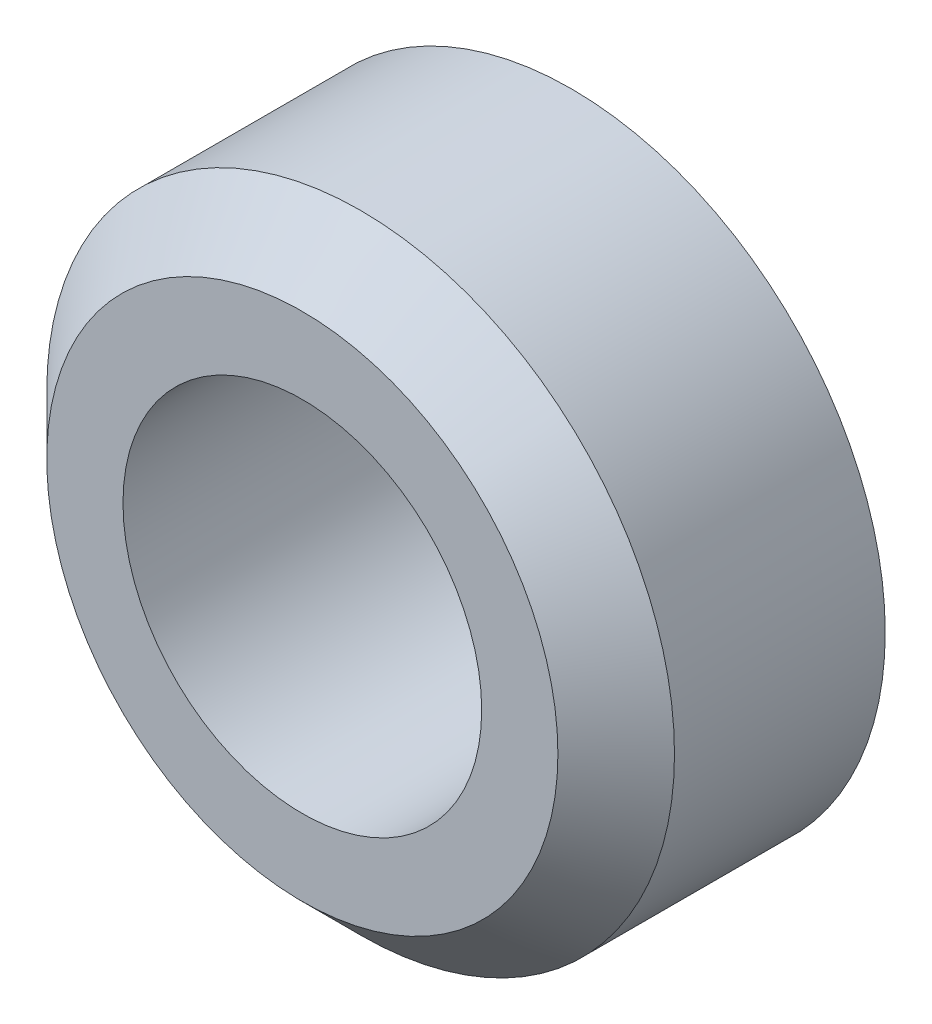
from build123d import *

# Parameters (mm, degrees)
SKETCH2_R           = 7
SKETCH2_R_2         = 4
BOSS_EXTRUDE1_DEPTH = 6
CHAMFER1_SIZE       = 1.3


with BuildPart() as part:
    # Sketch2 → Boss-Extrude1 (new body)
    with BuildSketch(Plane(origin=(0, 0, 0), x_dir=(0, 1, 0), z_dir=(0, 0, 1))):
        with Locations(Location((0, 0, 0), (0, 0, 270))):
            Circle(SKETCH2_R)
        with Locations(Location((0, 0, 0), (0, 0, 270))):
            Circle(SKETCH2_R_2, mode=Mode.SUBTRACT)
    extrude(amount=BOSS_EXTRUDE1_DEPTH)

    # Chamfer1
    chamfer1_edges = [part.edges().sort_by_distance(p)[0] for p in [
        (-7, 0, 6),
    ]]
    chamfer(chamfer1_edges, length=CHAMFER1_SIZE)


solid = part.part
